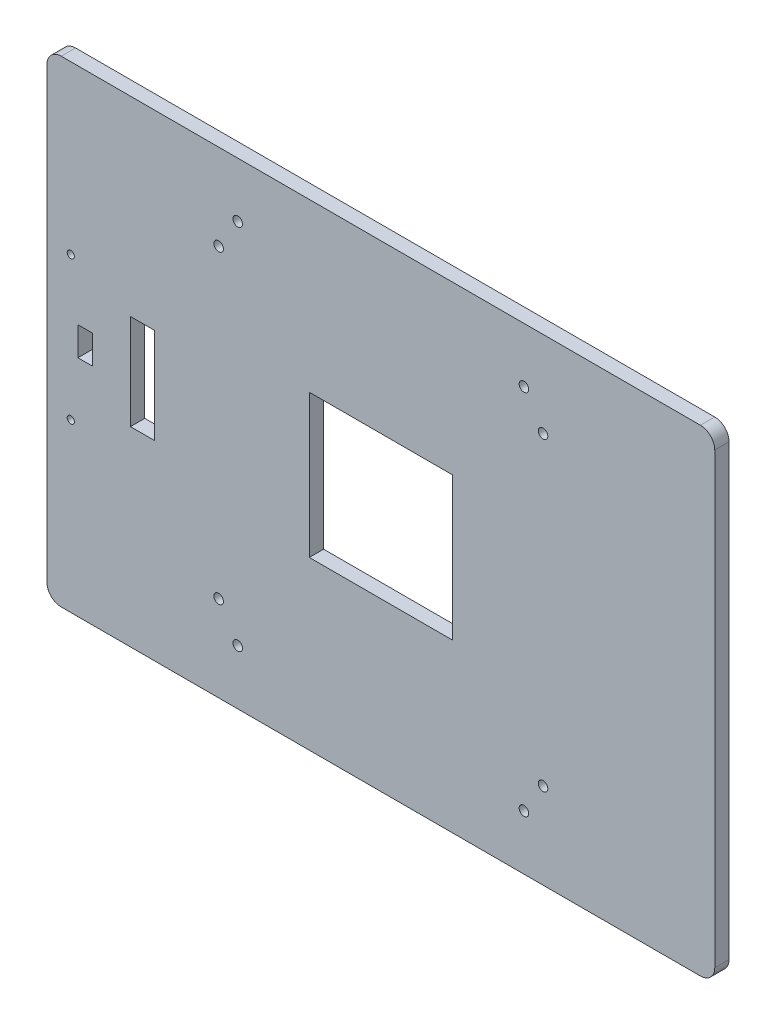
from build123d import *

# Parameters (mm, degrees)
SKETCH1_W           = 140
SKETCH1_H           = 100
BOSS_EXTRUDE1_DEPTH = 3
SKETCH2_R           = 1
CUT_EXTRUDE1_DEPTH  = 3
CUT_EXTRUDE2_REACH  = 88.076
SKETCH3_R           = 1
CUT_EXTRUDE3_REACH  = 88.076
SKETCH4_R           = 0.75
SKETCH4_W           = 30
SKETCH4_H           = 30
FILLET1_R           = 3
CUT_EXTRUDE4_REACH  = 88.076
SKETCH5_W           = 5
SKETCH5_H           = 20
CUT_EXTRUDE5_REACH  = 88.076
SKETCH6_W           = 3
SKETCH6_H           = 6


with BuildPart() as part:
    # Sketch1 → Boss-Extrude1 (new body)
    with BuildSketch(Plane.XY):
        Rectangle(SKETCH1_W, SKETCH1_H)
    extrude(amount=BOSS_EXTRUDE1_DEPTH)

    # Sketch2 → Cut-Extrude1 (cut)
    with BuildSketch(Plane.XY.offset(3)):
        with Locations((30, 38.5)):
            Circle(SKETCH2_R)
        with Locations((-30, 38.5)):
            Circle(SKETCH2_R)
        with Locations((30, -38.5)):
            Circle(SKETCH2_R)
        with Locations((-30, -38.5)):
            Circle(SKETCH2_R)
    extrude(amount=-CUT_EXTRUDE1_DEPTH, mode=Mode.SUBTRACT)

    # Sketch3 → Cut-Extrude2 (cut, up to next)
    with BuildSketch(Plane.XY.offset(3), mode=Mode.PRIVATE) as cut_extrude2_sk1:
        with Locations((34, 32)):
            Circle(SKETCH3_R)
    cut_extrude2_tool1 = extrude(cut_extrude2_sk1.sketch, amount=-CUT_EXTRUDE2_REACH, mode=Mode.PRIVATE) & part.part
    # Sketch3 → Cut-Extrude2 (cut, up to next)
    with BuildSketch(Plane.XY.offset(3), mode=Mode.PRIVATE) as cut_extrude2_sk2:
        with Locations((34, -32)):
            Circle(SKETCH3_R)
    cut_extrude2_tool2 = extrude(cut_extrude2_sk2.sketch, amount=-CUT_EXTRUDE2_REACH, mode=Mode.PRIVATE) & part.part
    # Sketch3 → Cut-Extrude2 (cut, up to next)
    with BuildSketch(Plane.XY.offset(3), mode=Mode.PRIVATE) as cut_extrude2_sk3:
        with Locations((-34, 32)):
            Circle(SKETCH3_R)
    cut_extrude2_tool3 = extrude(cut_extrude2_sk3.sketch, amount=-CUT_EXTRUDE2_REACH, mode=Mode.PRIVATE) & part.part
    # Sketch3 → Cut-Extrude2 (cut, up to next)
    with BuildSketch(Plane.XY.offset(3), mode=Mode.PRIVATE) as cut_extrude2_sk4:
        with Locations((-34, -32)):
            Circle(SKETCH3_R)
    cut_extrude2_tool4 = extrude(cut_extrude2_sk4.sketch, amount=-CUT_EXTRUDE2_REACH, mode=Mode.PRIVATE) & part.part
    add(cut_extrude2_tool1.solids().sort_by_distance((34, 32, 3))[0], mode=Mode.SUBTRACT)
    add(cut_extrude2_tool2.solids().sort_by_distance((34, -32, 3))[0], mode=Mode.SUBTRACT)
    add(cut_extrude2_tool3.solids().sort_by_distance((-34, 32, 3))[0], mode=Mode.SUBTRACT)
    add(cut_extrude2_tool4.solids().sort_by_distance((-34, -32, 3))[0], mode=Mode.SUBTRACT)

    # Sketch4 → Cut-Extrude3 (cut, up to next)
    with BuildSketch(Plane.XY.offset(3), mode=Mode.PRIVATE) as cut_extrude3_sk1:
        with Locations((-65, 15)):
            Circle(SKETCH4_R)
    cut_extrude3_tool1 = extrude(cut_extrude3_sk1.sketch, amount=-CUT_EXTRUDE3_REACH, mode=Mode.PRIVATE) & part.part
    # Sketch4 → Cut-Extrude3 (cut, up to next)
    with BuildSketch(Plane.XY.offset(3), mode=Mode.PRIVATE) as cut_extrude3_sk2:
        with Locations((-65, -15)):
            Circle(SKETCH4_R)
    cut_extrude3_tool2 = extrude(cut_extrude3_sk2.sketch, amount=-CUT_EXTRUDE3_REACH, mode=Mode.PRIVATE) & part.part
    # Sketch4 → Cut-Extrude3 (cut, up to next)
    with BuildSketch(Plane.XY.offset(3), mode=Mode.PRIVATE) as cut_extrude3_sk3:
        Rectangle(SKETCH4_W, SKETCH4_H)
    cut_extrude3_tool3 = extrude(cut_extrude3_sk3.sketch, amount=-CUT_EXTRUDE3_REACH, mode=Mode.PRIVATE) & part.part
    add(cut_extrude3_tool1.solids().sort_by_distance((-65, 15, 3))[0], mode=Mode.SUBTRACT)
    add(cut_extrude3_tool2.solids().sort_by_distance((-65, -15, 3))[0], mode=Mode.SUBTRACT)
    add(cut_extrude3_tool3.solids().sort_by_distance((0, 0, 3))[0], mode=Mode.SUBTRACT)

    # Fillet1
    fillet1_edges = [part.edges().sort_by_distance(p)[0] for p in [
        (70, -50, 1.5),
        (-70, -50, 1.5),
        (-70, 50, 1.5),
        (70, 50, 1.5),
    ]]
    fillet(fillet1_edges, radius=FILLET1_R)

    # Sketch5 → Cut-Extrude4 (cut, up to next)
    with BuildSketch(Plane.XY.offset(3), mode=Mode.PRIVATE) as cut_extrude4_sk1:
        with Locations((-50, 0)):
            Rectangle(SKETCH5_W, SKETCH5_H)
    cut_extrude4_tool1 = extrude(cut_extrude4_sk1.sketch, amount=-CUT_EXTRUDE4_REACH, mode=Mode.PRIVATE) & part.part
    add(cut_extrude4_tool1.solids().sort_by_distance((-50, 0, 3))[0], mode=Mode.SUBTRACT)

    # Sketch6 → Cut-Extrude5 (cut, up to next)
    with BuildSketch(Plane.XY.offset(3), mode=Mode.PRIVATE) as cut_extrude5_sk1:
        with Locations((-62, 0)):
            Rectangle(SKETCH6_W, SKETCH6_H)
    cut_extrude5_tool1 = extrude(cut_extrude5_sk1.sketch, amount=-CUT_EXTRUDE5_REACH, mode=Mode.PRIVATE) & part.part
    add(cut_extrude5_tool1.solids().sort_by_distance((-62, 0, 3))[0], mode=Mode.SUBTRACT)


solid = part.part
